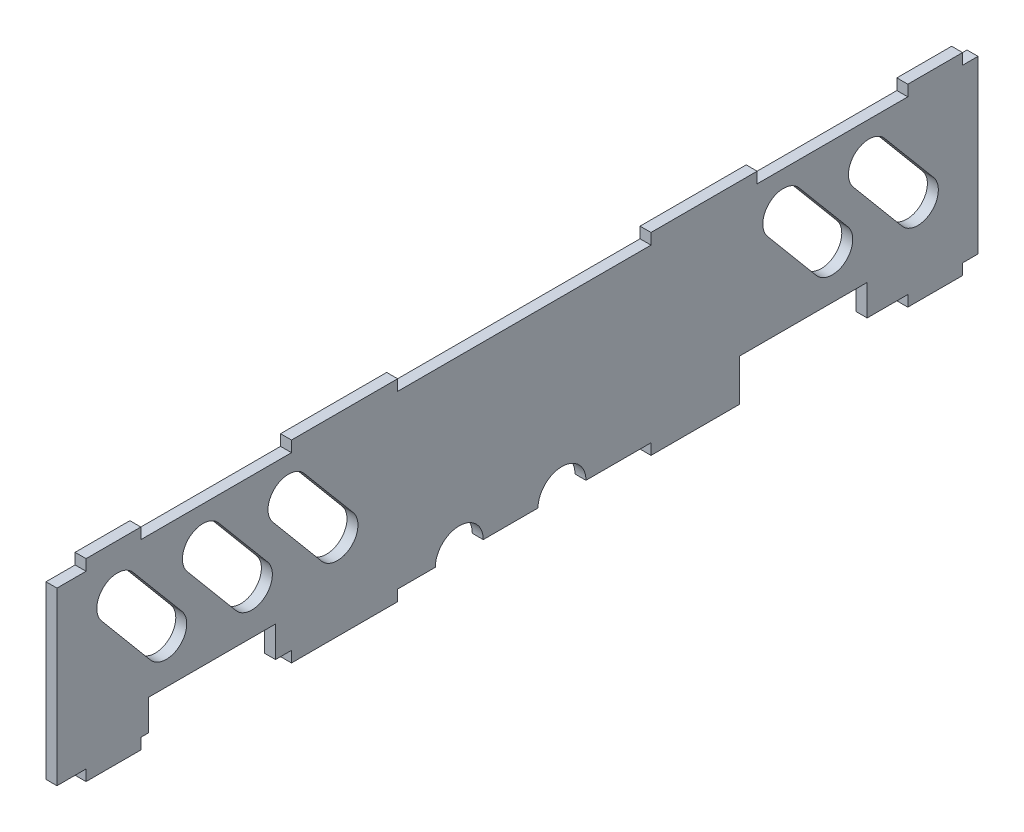
from build123d import *

# Parameters (mm, degrees)
EXTRUDE_1621_DEPTH     = 1.6
SKETCH3_W              = 18.561492042
SKETCH3_H              = 6.1
SKETCH3_W_2            = 18.663069739
CUT_EXTRUDE_3212_DEPTH = 135.908052021
CUT_EXTRUDE_3564_DEPTH = 1.6


with BuildPart() as part:
    # Sketch1 → Extrude 1621 (new body)
    with BuildSketch(Plane(origin=(0, 0, 0), x_dir=(0, 0, -1), z_dir=(1, 0, 0))):
        Polygon((0, -1.6), (0, 0), (2.25, 0), (2.25, 12.5), (-132.25, 12.5), (-132.25, 0), (-128, 0), (-128, -1.6), (-120, -1.6), (-120, 0), (-98, 0), (-98, -1.6), (-82.5, -1.6), (-82.5, 0), (-45.5, 0), (-45.5, -1.6), (-30, -1.6), (-30, 0), (-8, 0), (-8, -1.6), align=None)
    extrude(amount=EXTRUDE_1621_DEPTH)

    # Mirror1: part across plane


with BuildPart() as part_1:
    add(part.part)
    add(part.part.mirror(Plane(origin=(1.6, 12.5, 0), x_dir=(0, 0, 1), z_dir=(0, 1, 0))))

    # Sketch3 → Cut-Extrude 3212 (cut, through all)
    with BuildSketch(Plane(origin=(0, 0, 0), x_dir=(0, 0, -1), z_dir=(1, 0, 0))):
        with Locations((-109.620995127, 1.45)):
            Rectangle(SKETCH3_W, SKETCH3_H)
        with Locations((-23.26706902, 1.45)):
            Rectangle(SKETCH3_W_2, SKETCH3_H)
        with BuildLine():
            ThreePointArc((-70, 0), (-73.5, 3.5), (-77, 0))
            Line((-77, 0), (-70, 0))
        make_face()
        with BuildLine():
            ThreePointArc((-55, 0), (-58.5, 3.5), (-62, 0))
            Line((-62, 0), (-55, 0))
        make_face()
    extrude(amount=CUT_EXTRUDE_3212_DEPTH, mode=Mode.SUBTRACT)

    # Sketch4 → Cut-Extrude 3564 (cut)
    with BuildSketch(Plane(origin=(0, 0, 0), x_dir=(0, 0, -1), z_dir=(1, 0, 0))):
        with BuildLine():
            Line((-11.375951178, 21.428362829), (-4.243604313, 12.928362829))
            ThreePointArc((-4.243604313, 12.928362829), (-4.613374813, 8.701866671), (-8.839870972, 9.071637171))
            Line((-8.839870972, 9.071637171), (-15.972217837, 17.571637171))
            ThreePointArc((-15.972217837, 17.571637171), (-15.602447336, 21.798133329), (-11.375951178, 21.428362829))
        make_face()
        with BuildLine():
            Line((-121.131197482, 21.428362829), (-113.998850617, 12.928362829))
            ThreePointArc((-113.998850617, 12.928362829), (-114.368621117, 8.701866671), (-118.595117275, 9.071637171))
            Line((-118.595117275, 9.071637171), (-125.72746414, 17.571637171))
            ThreePointArc((-125.72746414, 17.571637171), (-125.35769364, 21.798133329), (-121.131197482, 21.428362829))
        make_face()
        with BuildLine():
            Line((-23.875951178, 21.428362829), (-16.743604313, 12.928362829))
            ThreePointArc((-16.743604313, 12.928362829), (-17.113374813, 8.701866671), (-21.339870972, 9.071637171))
            Line((-21.339870972, 9.071637171), (-28.472217837, 17.571637171))
            ThreePointArc((-28.472217837, 17.571637171), (-28.102447336, 21.798133329), (-23.875951178, 21.428362829))
        make_face()
        with BuildLine():
            Line((-108.631197482, 21.428362829), (-101.498850617, 12.928362829))
            ThreePointArc((-101.498850617, 12.928362829), (-101.868621117, 8.701866671), (-106.095117275, 9.071637171))
            Line((-106.095117275, 9.071637171), (-113.22746414, 17.571637171))
            ThreePointArc((-113.22746414, 17.571637171), (-112.85769364, 21.798133329), (-108.631197482, 21.428362829))
        make_face()
        with BuildLine():
            Line((-96.131197482, 21.428362829), (-88.998850617, 12.928362829))
            ThreePointArc((-88.998850617, 12.928362829), (-89.368621117, 8.701866671), (-93.595117275, 9.071637171))
            Line((-93.595117275, 9.071637171), (-100.72746414, 17.571637171))
            ThreePointArc((-100.72746414, 17.571637171), (-100.35769364, 21.798133329), (-96.131197482, 21.428362829))
        make_face()
    extrude(amount=CUT_EXTRUDE_3564_DEPTH, mode=Mode.SUBTRACT)


solid = part_1.part
